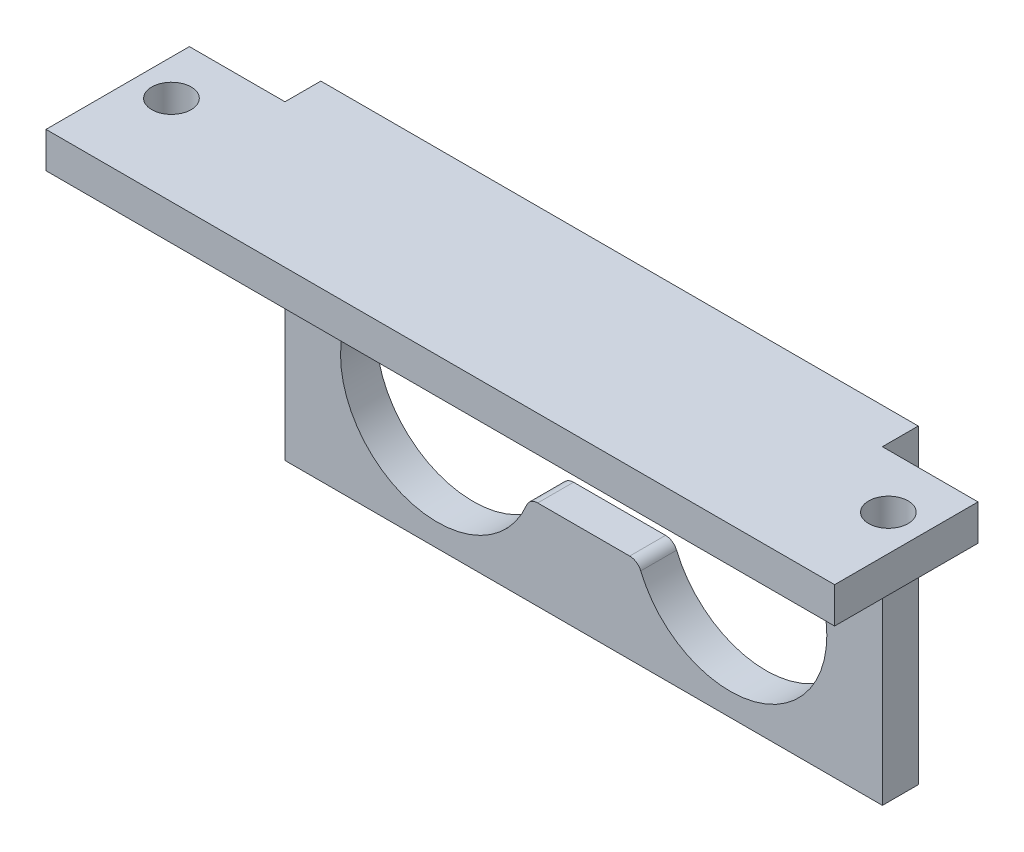
from build123d import *

# Parameters (mm, degrees)
SKETCH_1_W          = 50
SKETCH_1_H          = 20
EXTRUDE_1_DEPTH     = 3
SKETCH_2_W          = 50
SKETCH_2_H          = 15
EXTRUDE_2_DEPTH     = 6
SKETCH_5_W          = 50
SKETCH_5_H          = 12
CUT_EXTRUDE_2_DEPTH = 3
SKETCH_6_W          = 8
SKETCH_6_H          = 12
SKETCH_6_R          = 1.65
EXTRUDE_3_DEPTH     = 3


with BuildPart() as part:
    # 草图1 → 凸台-拉伸1 (new body)
    with BuildSketch(Plane.XY):
        Rectangle(SKETCH_1_W, SKETCH_1_H)
        with BuildLine():
            Line((-3.85, 2.5), (3.85, 2.5))
            ThreePointArc((3.85, 2.5), (4.404700196, 2.667949706), (4.773076923, 3.115384615))
            ThreePointArc((4.773076923, 3.115384615), (20.35, 0), (4.773076923, -3.115384615))
            ThreePointArc((4.773076923, -3.115384615), (4.404700196, -2.667949706), (3.85, -2.5))
            Line((3.85, -2.5), (-3.85, -2.5))
            ThreePointArc((-3.85, -2.5), (-4.404700196, -2.667949706), (-4.773076923, -3.115384615))
            ThreePointArc((-4.773076923, -3.115384615), (-20.35, 0), (-4.773076923, 3.115384615))
            ThreePointArc((-4.773076923, 3.115384615), (-4.404700196, 2.667949706), (-3.85, 2.5))
        make_face(mode=Mode.SUBTRACT)
        with BuildLine():
            Line((3.25, 5.5), (-3.25, 5.5))
            ThreePointArc((-3.25, 5.5), (-5, 7.25), (-3.25, 9))
            Line((-3.25, 9), (3.25, 9))
            ThreePointArc((3.25, 9), (5, 7.25), (3.25, 5.5))
        make_face(mode=Mode.SUBTRACT)
    extrude(amount=EXTRUDE_1_DEPTH)

    # 草图2 → 凸台-拉伸2 (add)
    with BuildSketch(Plane(origin=(0, 10, 0), x_dir=(1, 0, 0), z_dir=(0, 1, 0))):
        with Locations((0, -7.5)):
            Rectangle(SKETCH_2_W, SKETCH_2_H)
    extrude(amount=EXTRUDE_2_DEPTH)

    # 草图5 → 切除-拉伸2 (cut)
    with BuildSketch(Plane.XZ.offset(-10)):
        with Locations((0, 9)):
            Rectangle(SKETCH_5_W, SKETCH_5_H)
    extrude(amount=-CUT_EXTRUDE_2_DEPTH, mode=Mode.SUBTRACT)

    # 草图6 → 凸台-拉伸3 (add)
    # profile 1 of 2: a face of its own
    with BuildSketch(Plane(origin=(0, 16, 0), x_dir=(1, 0, 0), z_dir=(0, 1, 0))):
        with Locations((29, -9)):
            Rectangle(SKETCH_6_W, SKETCH_6_H)
        with Locations(Location((30, -7.5, 0), (0, 0, 180))):
            Circle(SKETCH_6_R, mode=Mode.SUBTRACT)
    # profile 2 of 2: a face of its own
    with BuildSketch(Plane(origin=(0, 16, 0), x_dir=(1, 0, 0), z_dir=(0, 1, 0))):
        with Locations((-29, -9)):
            Rectangle(SKETCH_6_W, SKETCH_6_H)
        with Locations(Location((-30, -7.5, 0), (0, 0, 180))):
            Circle(SKETCH_6_R, mode=Mode.SUBTRACT)
    extrude(amount=-EXTRUDE_3_DEPTH)


solid = part.part
